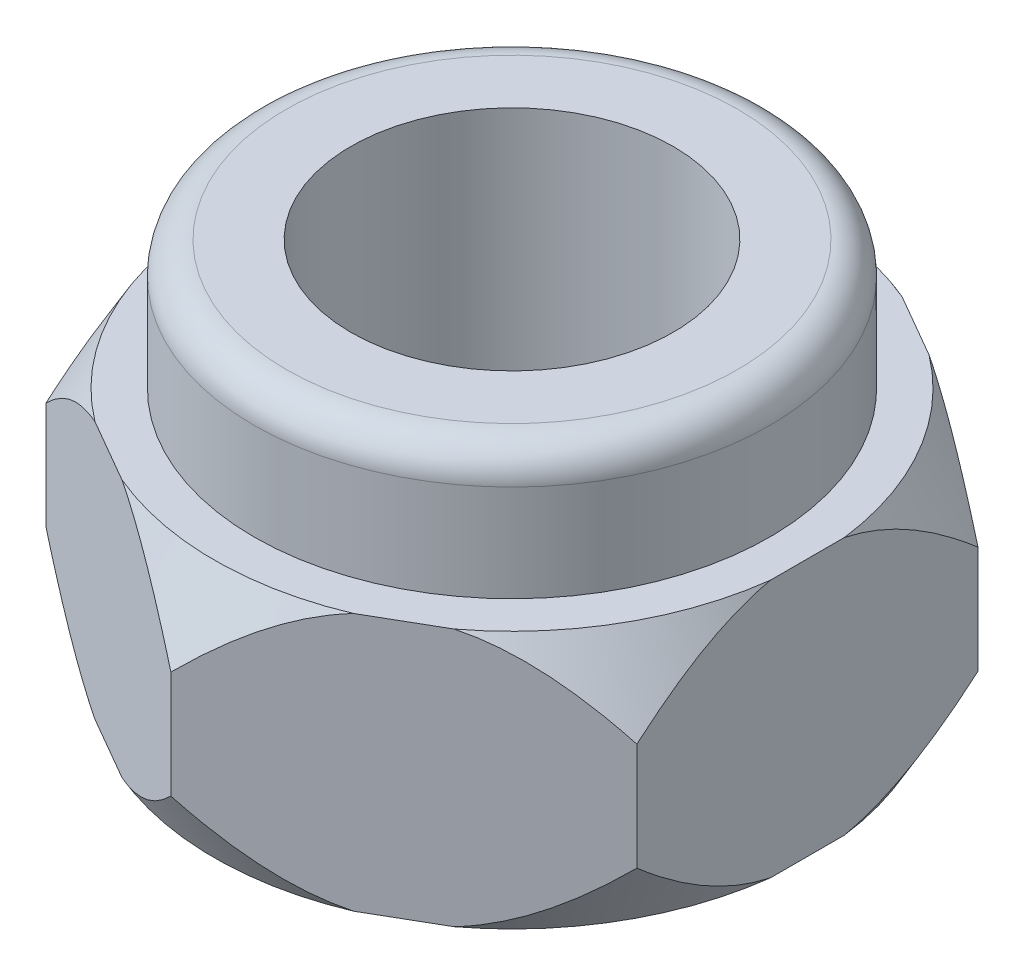
from build123d import *

# Parameters (mm, degrees)
SKETCH_1_R      = 1.5
EXTRUDE_1_DEPTH = 2.4
SKETCH_4_R      = 2.4
SKETCH_4_R_2    = 1.5
EXTRUDE_3_DEPTH = 1.2
FILLET_5_R      = 0.3


with BuildPart() as part:
    # 草图1 → 凸台-拉伸1 (new body)
    with BuildSketch(Plane(origin=(0, 0, 0), x_dir=(1, 0, 0), z_dir=(0, 1, 0))):
        Polygon((0, 3.175426481), (-2.75, 1.58771324), (-2.75, -1.58771324), (0, -3.175426481), (2.75, -1.58771324), (2.75, 1.58771324), align=None)
        with Locations(Location((0, 0, 0), (0, 0, 270))):
            Circle(SKETCH_1_R, mode=Mode.SUBTRACT)
    extrude(amount=EXTRUDE_1_DEPTH)

    # 草图3 → 切除-旋转7 (revolve, cut)
    with BuildSketch(Plane(origin=(0, 0, 0), x_dir=(0, 0, -1), z_dir=(1, 0, 0))):
        Polygon((0.384303775, 7.2), (4.083483307, 7.2), (4.083483307, -4.8), (0.297701235, -4.8), (0.297701235, -4.284366336), (3.464101615, 1.2), (0.384303775, 6.534366336), align=None)
    revolve(axis=Axis((0, 2.4, 0), (0, -1, 0)), mode=Mode.SUBTRACT)

    # 草图4 → 凸台-拉伸3 (add)
    with BuildSketch(Plane(origin=(0, 2.4, 0), x_dir=(1, 0, 0), z_dir=(0, 1, 0))):
        with Locations(Location((0, 0, 0), (0, 0, 270))):
            Circle(SKETCH_4_R)
        with Locations(Location((0, 0, 0), (0, 0, 270))):
            Circle(SKETCH_4_R_2, mode=Mode.SUBTRACT)
    extrude(amount=EXTRUDE_3_DEPTH)

    # 圆角5
    fillet_5_edges = [part.edges().sort_by_distance(p)[0] for p in [
        (0, 3.6, -2.4),
    ]]
    fillet(fillet_5_edges, radius=FILLET_5_R)


solid = part.part
